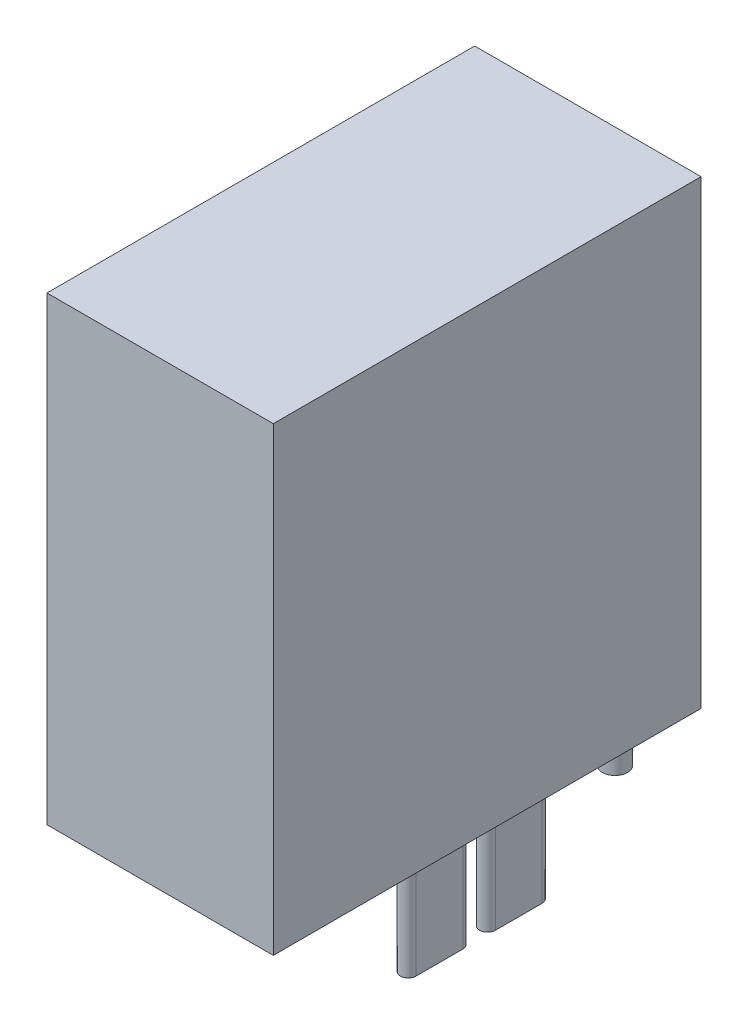
from build123d import *

# Parameters (mm, degrees)
ESQUISSE1_W      = 7.25
ESQUISSE1_H      = 14.75
EXTRUSION1_DEPTH = 13.7
EXTRUSION2_DEPTH = 3.65
ESQUISSE3_R      = 0.4
EXTRUSION3_DEPTH = 2


with BuildPart() as part:
    # Esquisse1 → Extrusion1 (new body)
    with BuildSketch(Plane.XY):
        with Locations((3.625, 7.375)):
            Rectangle(ESQUISSE1_W, ESQUISSE1_H)
    extrude(amount=EXTRUSION1_DEPTH)

    # Esquisse2 → Extrusion2 (add)
    with BuildSketch(Plane.XZ):
        with BuildLine():
            Line((1.04, 6.84), (1.04, 8.34))
            ThreePointArc((1.04, 8.34), (0.79, 8.59), (0.54, 8.34))
            Line((0.54, 8.34), (0.54, 6.84))
            ThreePointArc((0.54, 6.84), (0.79, 6.59), (1.04, 6.84))
        make_face()
        with BuildLine():
            Line((6.46, 6.84), (6.46, 8.34))
            ThreePointArc((6.46, 8.34), (6.21, 8.59), (5.96, 8.34))
            Line((5.96, 8.34), (5.96, 6.84))
            ThreePointArc((5.96, 6.84), (6.21, 6.59), (6.46, 6.84))
        make_face()
        with BuildLine():
            Line((1.04, 4.3), (1.04, 5.8))
            ThreePointArc((1.04, 5.8), (0.79, 6.05), (0.54, 5.8))
            Line((0.54, 5.8), (0.54, 4.3))
            ThreePointArc((0.54, 4.3), (0.79, 4.05), (1.04, 4.3))
        make_face()
        with BuildLine():
            Line((5.96, 4.3), (5.96, 5.8))
            ThreePointArc((5.96, 5.8), (6.21, 6.05), (6.46, 5.8))
            Line((6.46, 5.8), (6.46, 4.3))
            ThreePointArc((6.46, 4.3), (6.21, 4.05), (5.96, 4.3))
        make_face()
    extrude(amount=EXTRUSION2_DEPTH)

    # Esquisse3 → Extrusion3 (add)
    with BuildSketch(Plane.XZ):
        with Locations(Location((4.05, 0.956934673, 0), (0, 0, 90))):
            Circle(ESQUISSE3_R)
        with Locations(Location((2.65, 0.956934673, 0), (0, 0, 90))):
            Circle(ESQUISSE3_R)
        with Locations(Location((1.25, 0.956934673, 0), (0, 0, 90))):
            Circle(ESQUISSE3_R)
        with Locations(Location((5.45, 0.956934673, 0), (0, 0, 90))):
            Circle(ESQUISSE3_R)
    extrude(amount=EXTRUSION3_DEPTH)


solid = part.part
